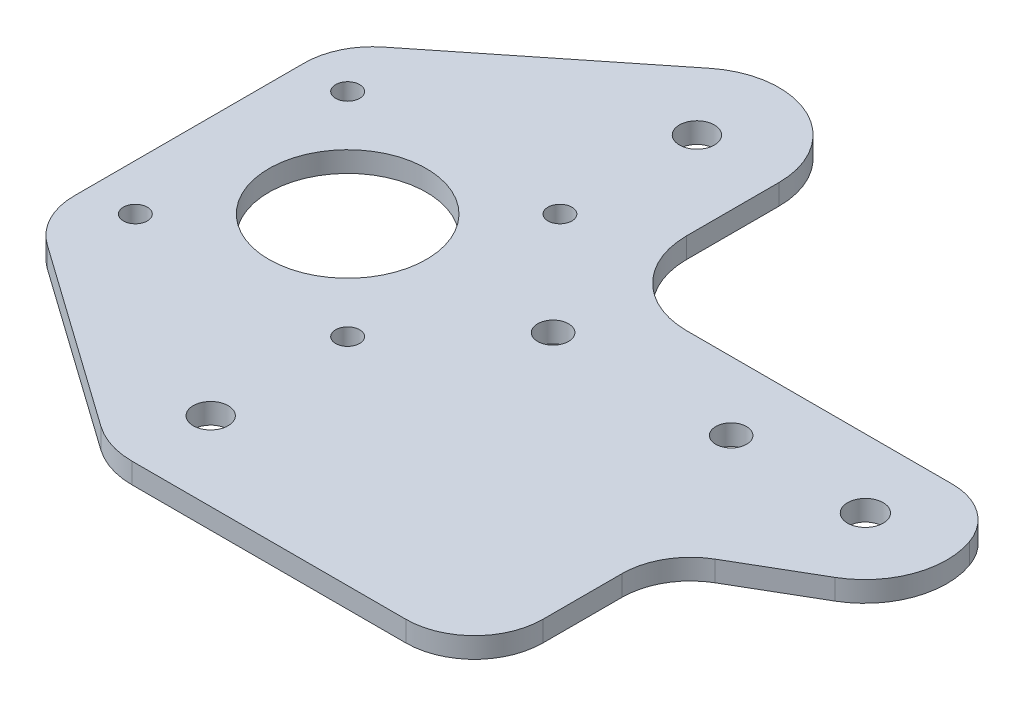
from build123d import *

# Parameters (mm, degrees)
SKETCH2_R           = 2.55
SKETCH2_R_2         = 1.75
SKETCH2_R_3         = 11.5
SKETCH2_R_4         = 2.25
SKETCH2_R_5         = 2.6
BOSS_EXTRUDE1_DEPTH = 3


with BuildPart() as part:
    # Sketch2 → Boss-Extrude1 (new body)
    with BuildSketch(Plane(origin=(0, 0, 0), x_dir=(1, 0, 0), z_dir=(0, 1, 0))):
        with BuildLine():
            Line((0, -16.785), (0, 16.785))
            ThreePointArc((0, 16.785), (0.990365412, 21.123949711), (3.76529692, 24.603470279))
            Line((3.76529692, 24.603470279), (30.285548105, 45.751583128))
            ThreePointArc((30.285548105, 45.751583128), (42.973931455, 47.180980298), (49.767191801, 36.369418793))
            Line((49.767191801, 36.369418793), (49.767191801, 22.869418793))
            ThreePointArc((49.767191801, 22.869418793), (53.281910427, 14.384137419), (61.767191801, 10.869418793))
            Line((61.767191801, 10.869418793), (100.597191801, 10.869418793))
            ThreePointArc((100.597191801, 10.869418793), (105.807473987, 9.207876366), (109.093955082, 4.836743136))
            ThreePointArc((109.093955082, 4.836743136), (109.021446628, -3.277934075), (103.801176734, -9.490986945))
            Line((103.801176734, -9.490986945), (92.738459269, -15.929642261))
            ThreePointArc((92.738459269, -15.929642261), (89.099691246, -19.587512883), (87.768658735, -24.572390281))
            Line((87.768658735, -24.572390281), (87.768658735, -36.122390281))
            ThreePointArc((87.768658735, -36.122390281), (84.839726547, -43.193458093), (77.768658735, -46.122390281))
            Line((77.768658735, -46.122390281), (37.768658735, -46.122390281))
            ThreePointArc((37.768658735, -46.122390281), (34.279940347, -45.58043956), (31.120041688, -44.005667499))
            Line((31.120041688, -44.005667499), (4.218593872, -24.944371494))
            ThreePointArc((4.218593872, -24.944371494), (1.117037057, -21.377708281), (0, -16.785))
        make_face()
        with Locations(Location((37.767191801, 36.369418793, 0), (0, 0, 270))):
            Circle(SKETCH2_R, mode=Mode.SUBTRACT)
        with Locations(Location((37.767191801, 16.369418793, 0), (0, 0, 270))):
            Circle(SKETCH2_R_2, mode=Mode.SUBTRACT)
        with Locations(Location((22.26, 0.877609719, 0), (0, 0, 270))):
            Circle(SKETCH2_R_3, mode=Mode.SUBTRACT)
        with Locations(Location((37.767191801, -14.630581207, 0), (0, 0, 270))):
            Circle(SKETCH2_R_2, mode=Mode.SUBTRACT)
        with Locations(Location((6.767191801, -14.630581207, 0), (0, 0, 270))):
            Circle(SKETCH2_R_2, mode=Mode.SUBTRACT)
        with Locations(Location((6.767191801, 16.369418793, 0), (0, 0, 270))):
            Circle(SKETCH2_R_2, mode=Mode.SUBTRACT)
        with Locations(Location((52.26, 0.877609719, 0), (0, 0, 270))):
            Circle(SKETCH2_R_4, mode=Mode.SUBTRACT)
        with Locations(Location((78.26, 0.877609719, 0), (0, 0, 270))):
            Circle(SKETCH2_R_4, mode=Mode.SUBTRACT)
        with Locations(Location((97.86, 0.877609719, 0), (0, 0, 270))):
            Circle(SKETCH2_R_5, mode=Mode.SUBTRACT)
        with Locations(Location((37.767191801, -34.630581207, 0), (0, 0, 270))):
            Circle(SKETCH2_R, mode=Mode.SUBTRACT)
    extrude(amount=BOSS_EXTRUDE1_DEPTH)


solid = part.part
